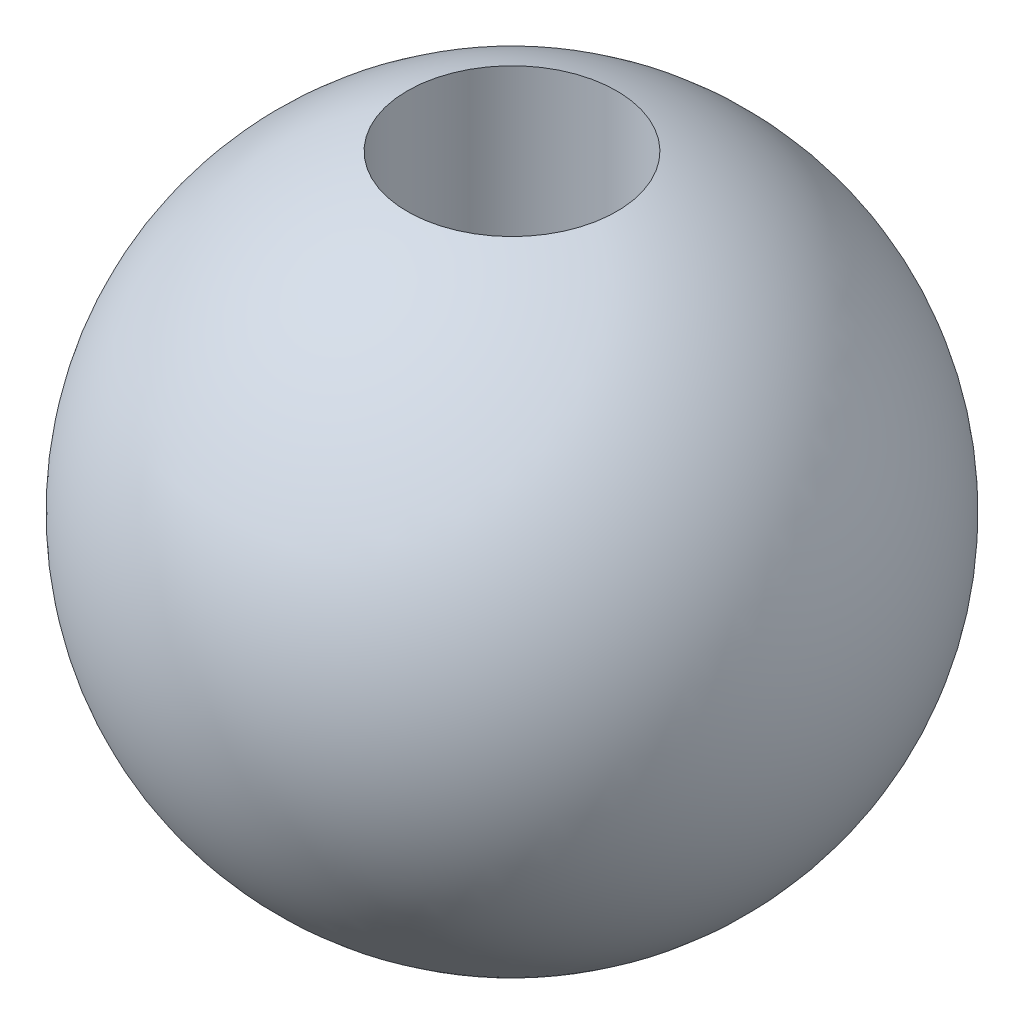
from build123d import *


with BuildPart() as part:
    # Sketch1 → Revolve1 (revolve)
    with BuildSketch(Plane.XY):
        with BuildLine():
            Line((-0.381, 1.137909926), (-0.381, -1.137909926))
            ThreePointArc((-0.381, -1.137909926), (-1.2, 0), (-0.381, 1.137909926))
        make_face()
    revolve(axis=Axis((0, 0, 0), (0, 1, 0)))


solid = part.part
